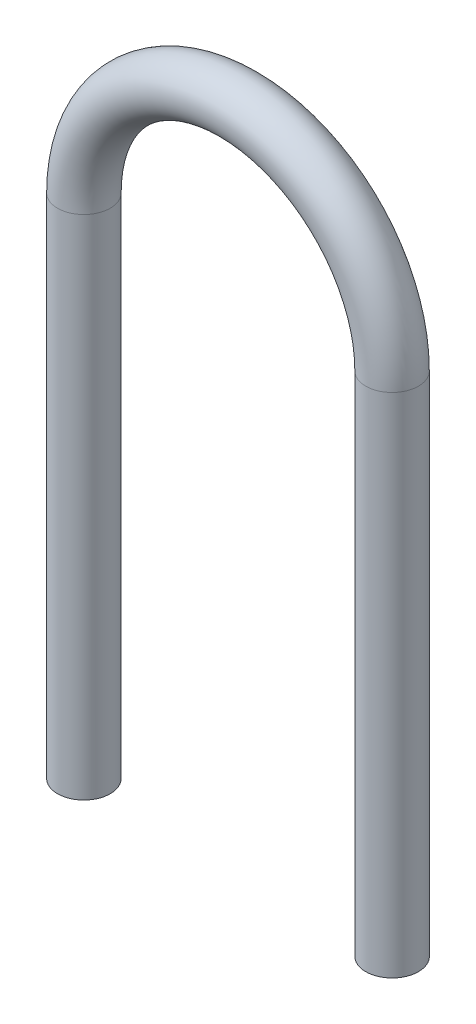
from build123d import *

# Parameters (mm, degrees)
SKETCH1_R             = 0.508
BOSS_EXTRUDE1_DEPTH   = 9.779
BOSS_EXTRUDE1_2_DEPTH = 9.779
SKETCH4_R             = 0.508


with BuildPart() as part:
    # Sketch1 → Boss-Extrude1 (new body)
    with BuildSketch(Plane(origin=(0, 0, 0), x_dir=(1, 0, 0), z_dir=(0, 1, 0))):
        with Locations(Location((0, 0, 0), (0, 0, 270))):
            Circle(SKETCH1_R)
    extrude(amount=BOSS_EXTRUDE1_DEPTH)



with BuildPart() as body_2:
    # Sketch1 → Boss-Extrude1 2 (new body)
    with BuildSketch(Plane(origin=(0, 0, 0), x_dir=(1, 0, 0), z_dir=(0, 1, 0))):
        with Locations(Location((5.9436, 0, 0), (0, 0, 270))):
            Circle(SKETCH1_R)
    extrude(amount=BOSS_EXTRUDE1_2_DEPTH)


with BuildPart() as part_1:
    add(part.part)

    add(body_2.part)  # Sweep1 merges body 2
    # Sweep1: sweep along a path in Sketch3
    with BuildLine(Plane.XY) as sweep1_path:
        ThreePointArc((0, 9.779), (2.9718, 12.7508), (5.9436, 9.779))
    # Sketch4 → Sweep1 (sweep)
    with BuildSketch(Plane(origin=(0, 9.779, 0), x_dir=(1, 0, 0), z_dir=(0, 1, 0))):
        Circle(SKETCH4_R)
    sweep(path=sweep1_path.line)


solid = part_1.part
